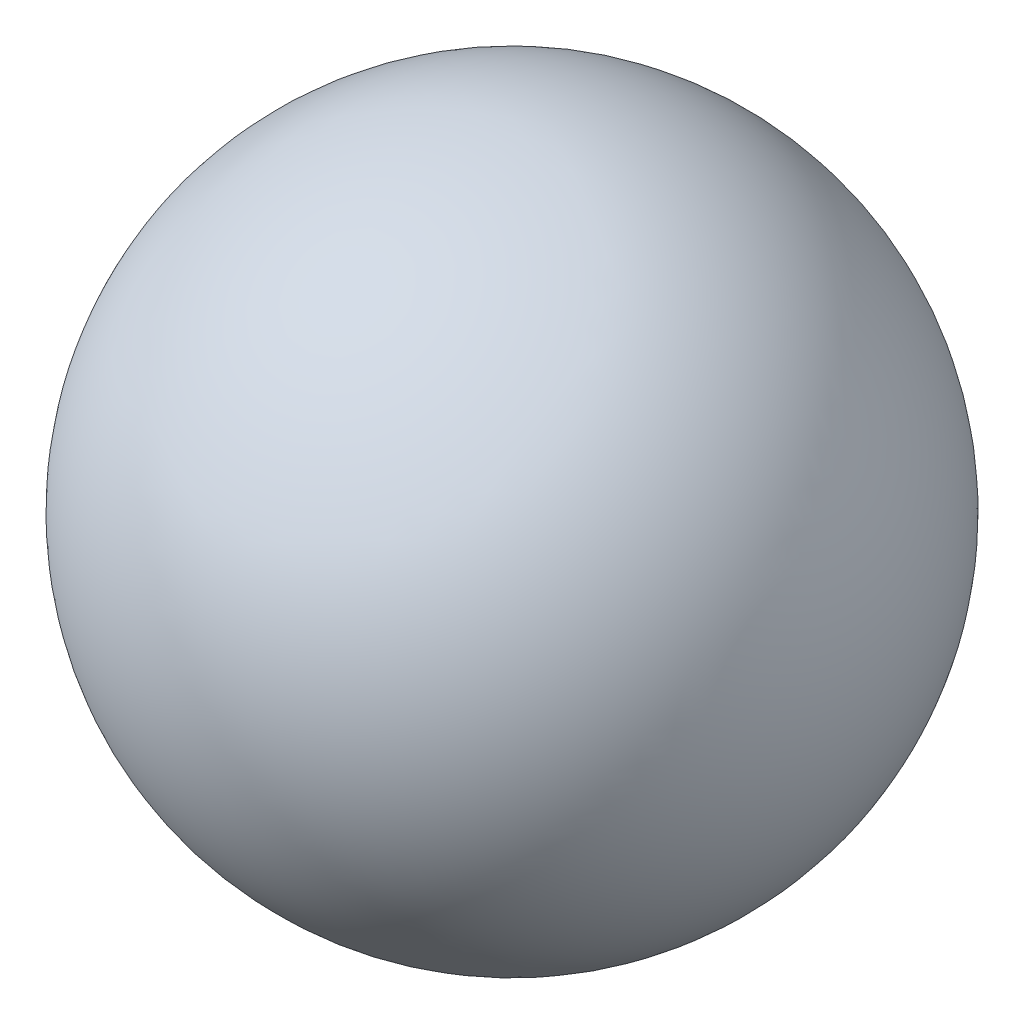
from build123d import *


with BuildPart() as part:
    # Sketch2 → Revolve4 (revolve)
    with BuildSketch(Plane(origin=(0, 0, 0), x_dir=(1, 0, 0), z_dir=(0, 1, 0))):
        with BuildLine():
            Line((-5.75, 0), (5.75, 0))
            ThreePointArc((5.75, 0), (0, 5.75), (-5.75, 0))
        make_face()
    revolve(axis=Axis((-5.75, 0, 0), (1, 0, 0)))


solid = part.part
